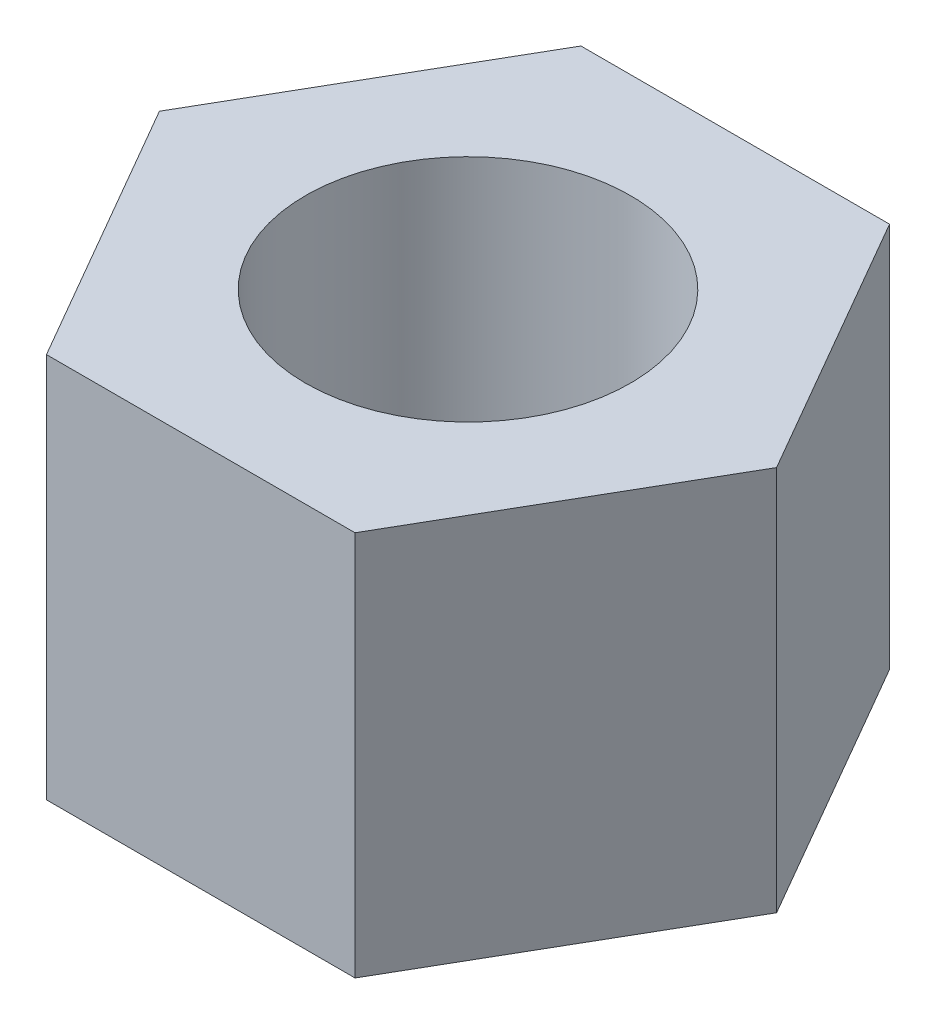
from build123d import *

# Parameters (mm, degrees)
SZKIC1_R                    = 4.215
DODANIE_WYCI_GNI_CIE1_DEPTH = 10


with BuildPart() as part:
    # Szkic1 → Dodanie-wyciągnięcie1 (new body)
    with BuildSketch(Plane(origin=(0, 0, 0), x_dir=(1, 0, 0), z_dir=(0, 1, 0))):
        Polygon((8.003101394, 0), (4.001550697, 6.930889116), (-4.001550697, 6.930889116), (-8.003101394, 0), (-4.001550697, -6.930889116), (4.001550697, -6.930889116), align=None)
        with Locations(Location((0, 0, 0), (0, 0, 270))):
            Circle(SZKIC1_R, mode=Mode.SUBTRACT)
    extrude(amount=DODANIE_WYCI_GNI_CIE1_DEPTH)


solid = part.part
